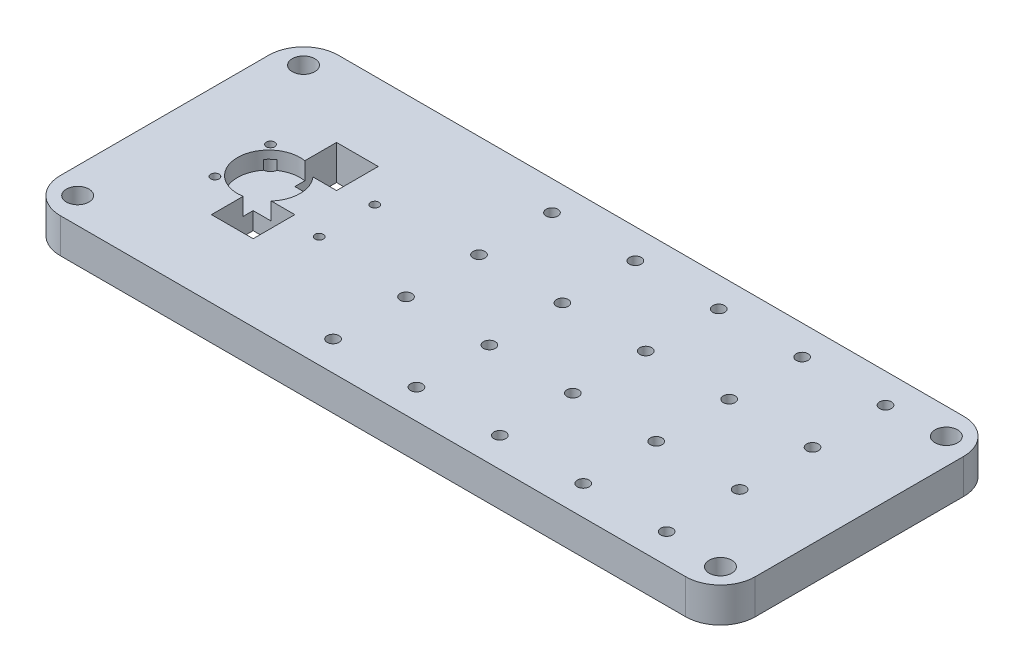
from build123d import *

# Parameters (mm, degrees)
SKETCH_1_W                   = 200
SKETCH_1_H                   = 80
EXTRUDE_1_DEPTH              = 10
SKETCH_3_R                   = 9
CUT_EXTRUDE_1_DEPTH          = 5
HOLE_WIZARD_M2_1_D           = 2.4
HOLE_WIZARD_M2_1_CBORE_D     = 5
HOLE_WIZARD_M2_1_CBORE_DEPTH = 7.7
SKETCH_13_R                  = 1.7
CUT_EXTRUDE_3_DEPTH          = 109.166538264
SKETCH_14_R                  = 3.25
CUT_EXTRUDE_4_DEPTH          = 109.166538264
FILLET1_R                    = 10
SKETCH3_W                    = 12
SKETCH3_H                    = 12
CUT_EXTRUDE2_DEPTH           = 109.166538264


with BuildPart() as part:
    # 草图1 → 凸台-拉伸1 (new body)
    with BuildSketch(Plane(origin=(0, 0, 0), x_dir=(1, 0, 0), z_dir=(0, 1, 0))):
        Rectangle(SKETCH_1_W, SKETCH_1_H)
    extrude(amount=EXTRUDE_1_DEPTH)

    # 草图3 → 切除-拉伸1 (cut)
    with BuildSketch(Plane(origin=(0, 10, 0), x_dir=(1, 0, 0), z_dir=(0, 1, 0))):
        with Locations(Location((-70, 0, 0), (0, 0, 270))):
            Circle(SKETCH_3_R)
    extrude(amount=-CUT_EXTRUDE_1_DEPTH, mode=Mode.SUBTRACT)

    # M2 六角凹头螺钉的柱形沉头孔1 (through all)
    with Locations(Plane(origin=(0, 0, 0), x_dir=(-1, 0, 0), z_dir=(0, -1, 0))):
        with Locations((47.5, 8), (77.5, 8), (77.5, -8), (47.5, -8)):
            CounterBoreHole(HOLE_WIZARD_M2_1_D / 2, HOLE_WIZARD_M2_1_CBORE_D / 2, HOLE_WIZARD_M2_1_CBORE_DEPTH)

    # 草图13 → 切除-拉伸3 (cut, through all)
    with BuildSketch(Plane(origin=(0, 10, 0), x_dir=(1, 0, 0), z_dir=(0, 1, 0))):
        with Locations(Location((-20, 31.5, 0), (0, 0, 270))):
            Circle(SKETCH_13_R)
        with Locations(Location((4, 31.5, 0), (0, 0, 270))):
            Circle(SKETCH_13_R)
        with Locations(Location((28, 31.5, 0), (0, 0, 270))):
            Circle(SKETCH_13_R)
        with Locations(Location((52, 31.5, 0), (0, 0, 270))):
            Circle(SKETCH_13_R)
        with Locations(Location((76, 31.5, 0), (0, 0, 270))):
            Circle(SKETCH_13_R)
        with Locations(Location((4, 10.5, 0), (0, 0, 270))):
            Circle(SKETCH_13_R)
        with Locations(Location((28, 10.5, 0), (0, 0, 270))):
            Circle(SKETCH_13_R)
        with Locations(Location((52, 10.5, 0), (0, 0, 270))):
            Circle(SKETCH_13_R)
        with Locations(Location((76, 10.5, 0), (0, 0, 270))):
            Circle(SKETCH_13_R)
        with Locations(Location((4, -10.5, 0), (0, 0, 270))):
            Circle(SKETCH_13_R)
        with Locations(Location((28, -10.5, 0), (0, 0, 270))):
            Circle(SKETCH_13_R)
        with Locations(Location((52, -10.5, 0), (0, 0, 270))):
            Circle(SKETCH_13_R)
        with Locations(Location((76, -10.5, 0), (0, 0, 270))):
            Circle(SKETCH_13_R)
        with Locations(Location((4, -31.5, 0), (0, 0, 270))):
            Circle(SKETCH_13_R)
        with Locations(Location((28, -31.5, 0), (0, 0, 270))):
            Circle(SKETCH_13_R)
        with Locations(Location((52, -31.5, 0), (0, 0, 270))):
            Circle(SKETCH_13_R)
        with Locations(Location((76, -31.5, 0), (0, 0, 270))):
            Circle(SKETCH_13_R)
        with Locations(Location((-20, 10.5, 0), (0, 0, 270))):
            Circle(SKETCH_13_R)
        with Locations(Location((-20, -10.5, 0), (0, 0, 270))):
            Circle(SKETCH_13_R)
        with Locations(Location((-20, -31.5, 0), (0, 0, 270))):
            Circle(SKETCH_13_R)
    extrude(amount=-CUT_EXTRUDE_3_DEPTH, mode=Mode.SUBTRACT)

    # 草图14 → 切除-拉伸4 (cut, through all)
    with BuildSketch(Plane(origin=(0, 10, 0), x_dir=(1, 0, 0), z_dir=(0, 1, 0))):
        with Locations(Location((-92.5, 32.5, 0), (0, 0, 270))):
            Circle(SKETCH_14_R)
        with Locations(Location((92.5, 32.5, 0), (0, 0, 90))):
            Circle(SKETCH_14_R)
        with Locations(Location((92.5, -32.5, 0), (0, 0, 270))):
            Circle(SKETCH_14_R)
        with Locations(Location((-92.5, -32.5, 0), (0, 0, 90))):
            Circle(SKETCH_14_R)
    extrude(amount=-CUT_EXTRUDE_4_DEPTH, mode=Mode.SUBTRACT)

    # Fillet1
    fillet1_edges = [part.edges().sort_by_distance(p)[0] for p in [
        (100, 5, 40),
        (-100, 5, 40),
        (-100, 5, -40),
        (100, 5, -40),
    ]]
    fillet(fillet1_edges, radius=FILLET1_R)

    # Sketch3 → Cut-Extrude2 (cut, through all)
    with BuildSketch(Plane(origin=(0, 10, 0), x_dir=(1, 0, 0), z_dir=(0, 1, 0))):
        with Locations((-62.5, -12)):
            Rectangle(SKETCH3_W, SKETCH3_H)
        with Locations((-62.5, 12)):
            Rectangle(SKETCH3_W, SKETCH3_H)
    extrude(amount=-CUT_EXTRUDE2_DEPTH, mode=Mode.SUBTRACT)


solid = part.part
